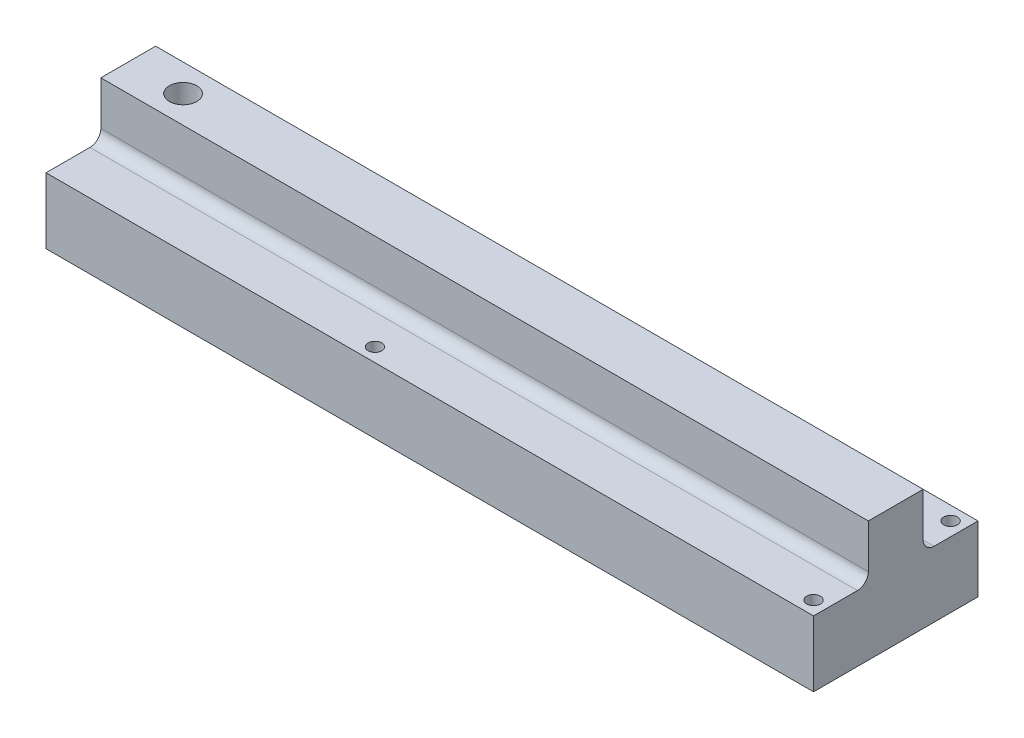
from build123d import *

# Parameters (mm, degrees)
BOSS_EXTRUDE1_DEPTH = 280
SKETCH3_R           = 2.5
CUT_EXTRUDE2_DEPTH  = 8
FILLET1_R           = 4
SKETCH4_R           = 5
CUT_EXTRUDE3_DEPTH  = 10


with BuildPart() as part:
    # Sketch1 → Boss-Extrude1 (new body)
    with BuildSketch(Plane(origin=(0, 0, 0), x_dir=(0, 0, -1), z_dir=(1, 0, 0))):
        Polygon((0, 0), (-60, 0), (-60, 24), (-40, 24), (-40, 44), (-20, 44), (-20, 24), (0, 24), align=None)
    extrude(amount=BOSS_EXTRUDE1_DEPTH)

    # Sketch3 → Cut-Extrude2 (cut)
    with BuildSketch(Plane(origin=(0, 24, 0), x_dir=(1, 0, 0), z_dir=(0, 1, 0))):
        with Locations(Location((115, -55, 0), (0, 0, 270))):
            Circle(SKETCH3_R)
        with Locations(Location((275, -55, 0), (0, 0, 270))):
            Circle(SKETCH3_R)
        with Locations(Location((275, -5, 0), (0, 0, 90))):
            Circle(SKETCH3_R)
        with Locations(Location((115, -5, 0), (0, 0, 90))):
            Circle(SKETCH3_R)
    extrude(amount=-CUT_EXTRUDE2_DEPTH, mode=Mode.SUBTRACT)

    # Fillet1
    fillet1_edges = [part.edges().sort_by_distance(p)[0] for p in [
        (140, 24, 40),
        (140, 24, 20),
    ]]
    fillet(fillet1_edges, radius=FILLET1_R)

    # Sketch4 → Cut-Extrude3 (cut)
    with BuildSketch(Plane(origin=(0, 44, 0), x_dir=(1, 0, 0), z_dir=(0, 1, 0))):
        with Locations(Location((20, -30, 0), (0, 0, 270))):
            Circle(SKETCH4_R)
    extrude(amount=-CUT_EXTRUDE3_DEPTH, mode=Mode.SUBTRACT)


solid = part.part
